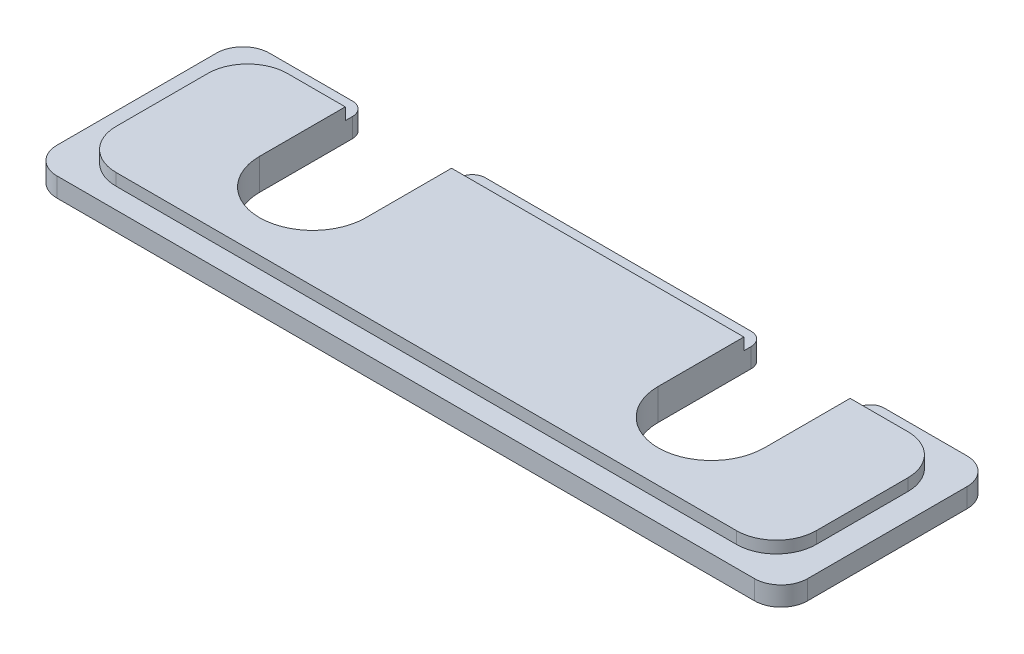
from build123d import *

# Parameters (mm, degrees)
BOSS_EXTRUDE1_DEPTH = 1.45
BOSS_EXTRUDE2_DEPTH = 0.9
CUT_EXTRUDE1_DEPTH  = 30.454795874
FILLET1_R           = 1


with BuildPart() as part:
    # Sketch1 → Boss-Extrude1 (new body)
    with BuildSketch(Plane(origin=(0, 0, 0), x_dir=(1, 0, 0), z_dir=(0, 1, 0))):
        with BuildLine():
            Line((-26.25, -8), (26.25, -8))
            ThreePointArc((26.25, -8), (27.664213562, -7.414213562), (28.25, -6))
            Line((28.25, -6), (28.25, 6))
            ThreePointArc((28.25, 6), (27.664213562, 7.414213562), (26.25, 8))
            Line((26.25, 8), (-26.25, 8))
            ThreePointArc((-26.25, 8), (-27.664213562, 7.414213562), (-28.25, 6))
            Line((-28.25, 6), (-28.25, -6))
            ThreePointArc((-28.25, -6), (-27.664213562, -7.414213562), (-26.25, -8))
        make_face()
    extrude(amount=BOSS_EXTRUDE1_DEPTH)

    # Sketch2 → Boss-Extrude2 (add)
    with BuildSketch(Plane(origin=(0, 1.45, 0), x_dir=(1, 0, 0), z_dir=(0, 1, 0))):
        with BuildLine():
            Line((-23.35, -6.45), (23.35, -6.45))
            ThreePointArc((23.35, -6.45), (25.471320344, -5.571320344), (26.35, -3.45))
            Line((26.35, -3.45), (26.35, 3.45))
            ThreePointArc((26.35, 3.45), (25.471320344, 5.571320344), (23.35, 6.45))
            Line((23.35, 6.45), (-23.35, 6.45))
            ThreePointArc((-23.35, 6.45), (-25.471320344, 5.571320344), (-26.35, 3.45))
            Line((-26.35, 3.45), (-26.35, -3.45))
            ThreePointArc((-26.35, -3.45), (-25.471320344, -5.571320344), (-23.35, -6.45))
        make_face()
    extrude(amount=BOSS_EXTRUDE2_DEPTH)

    # Sketch3 → Cut-Extrude1 (cut, through all)
    with BuildSketch(Plane(origin=(0, 2.35, 0), x_dir=(1, 0, 0), z_dir=(0, 1, 0))):
        with BuildLine():
            Line((-19, 0), (-19, 8))
            Line((-19, 8), (-11, 8))
            Line((-11, 8), (-11, 0))
            ThreePointArc((-11, 0), (-15, -4), (-19, 0))
        make_face()
        with BuildLine():
            Line((11, 0), (11, 8))
            Line((11, 8), (19, 8))
            Line((19, 8), (19, 0))
            ThreePointArc((19, 0), (15, -4), (11, 0))
        make_face()
    extrude(amount=-CUT_EXTRUDE1_DEPTH, mode=Mode.SUBTRACT)

    # Fillet1
    fillet1_edges = [part.edges().sort_by_distance(p)[0] for p in [
        (11, 0.725, -8),
        (19, 0.725, -8),
        (-19, 0.725, -8),
        (-11, 0.725, -8),
    ]]
    fillet(fillet1_edges, radius=FILLET1_R)


solid = part.part
